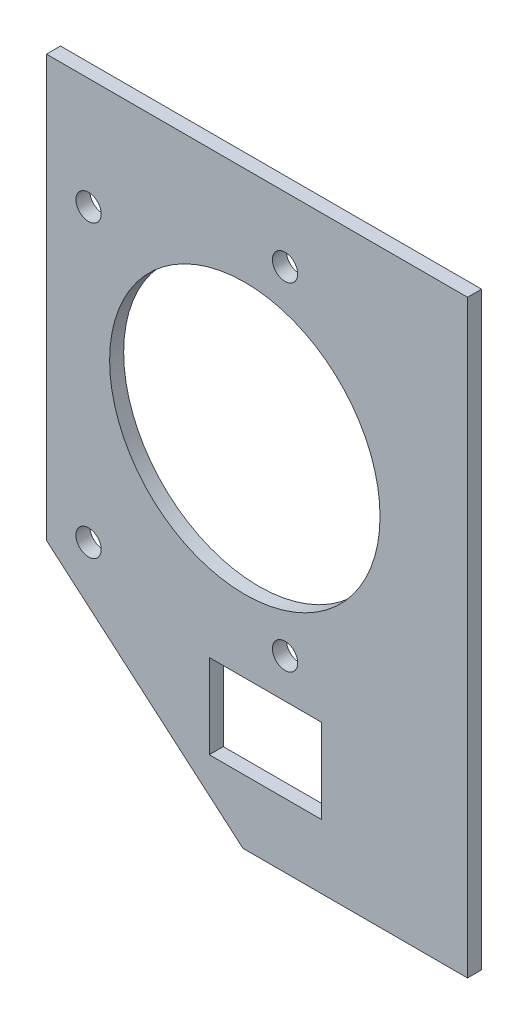
from build123d import *

# Parameters (mm, degrees)
ESQUISSE1_W             = 150
ESQUISSE1_H             = 210
BOSS_EXTRU_1_DEPTH      = 5
D_GAGEMENT_M81_D        = 9
ESQUISSE5_W             = 40
ESQUISSE5_H             = 30
ENL_V_MAT_EXTRU_1_DEPTH = 5
ENL_V_MAT_EXTRU_2_DEPTH = 5
ESQUISSE7_R             = 48.156846138
ENL_V_MAT_EXTRU_3_DEPTH = 5


with BuildPart() as part:
    # Esquisse1 → Boss.-Extru.1 (new body)
    with BuildSketch(Plane.XY):
        with Locations((75, -105)):
            Rectangle(ESQUISSE1_W, ESQUISSE1_H)
    extrude(amount=BOSS_EXTRU_1_DEPTH)

    # Dégagement M81 (through all)
    with Locations(Plane.XY.offset(5)):
        with Locations((85, -23.12089623), (85, -143.12089623), (15, -143.12089623), (15, -39.62089623)):
            Hole(D_GAGEMENT_M81_D / 2)

    # Esquisse5 → Enlèv. mat.-Extru.1 (cut)
    with BuildSketch(Plane.XY.offset(5)):
        with Locations((78, -172.12089623)):
            Rectangle(ESQUISSE5_W, ESQUISSE5_H)
    extrude(amount=-ENL_V_MAT_EXTRU_1_DEPTH, mode=Mode.SUBTRACT)

    # Esquisse6 → Enlèv. mat.-Extru.2 (cut)
    with BuildSketch(Plane.XY.offset(5)):
        Polygon((0, -210), (0, -150), (70, -210), align=None)
    extrude(amount=-ENL_V_MAT_EXTRU_2_DEPTH, mode=Mode.SUBTRACT)

    # Esquisse7 → Enlèv. mat.-Extru.3 (cut)
    with BuildSketch(Plane.XY.offset(5)):
        with Locations((70.667772287, -83.194453846)):
            Circle(ESQUISSE7_R)
    extrude(amount=-ENL_V_MAT_EXTRU_3_DEPTH, mode=Mode.SUBTRACT)


solid = part.part
